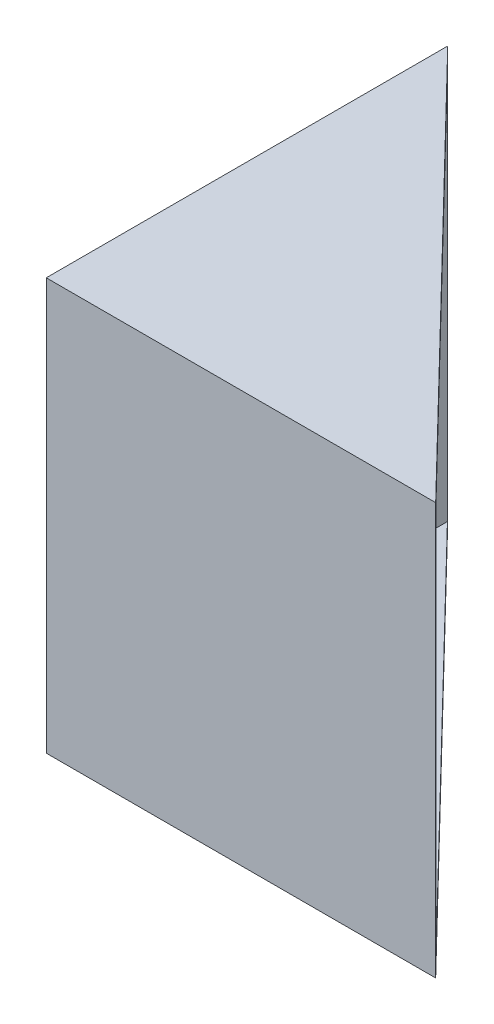
from build123d import *

# Parameters (mm, degrees)
BOSS_EXTRUDE1_DEPTH = 80
SHELL2_T            = -2


with BuildPart() as part:
    # Sketch1 → Boss-Extrude1 (new body)
    with BuildSketch(Plane(origin=(0, 0, 0), x_dir=(1, 0, 0), z_dir=(0, 1, 0))):
        Polygon((-22.5, -22.5), (53.168499604, -22.5), (-22.5, 55.514331091), align=None)
    extrude(amount=BOSS_EXTRUDE1_DEPTH)

    # Shell2
    shell2_openings = [part.faces().sort_by_distance(p)[0] for p in [
        (15.334249802, 40, -16.507165546),
    ]]
    offset(amount=SHELL2_T, openings=shell2_openings, kind=Kind.INTERSECTION)


solid = part.part
